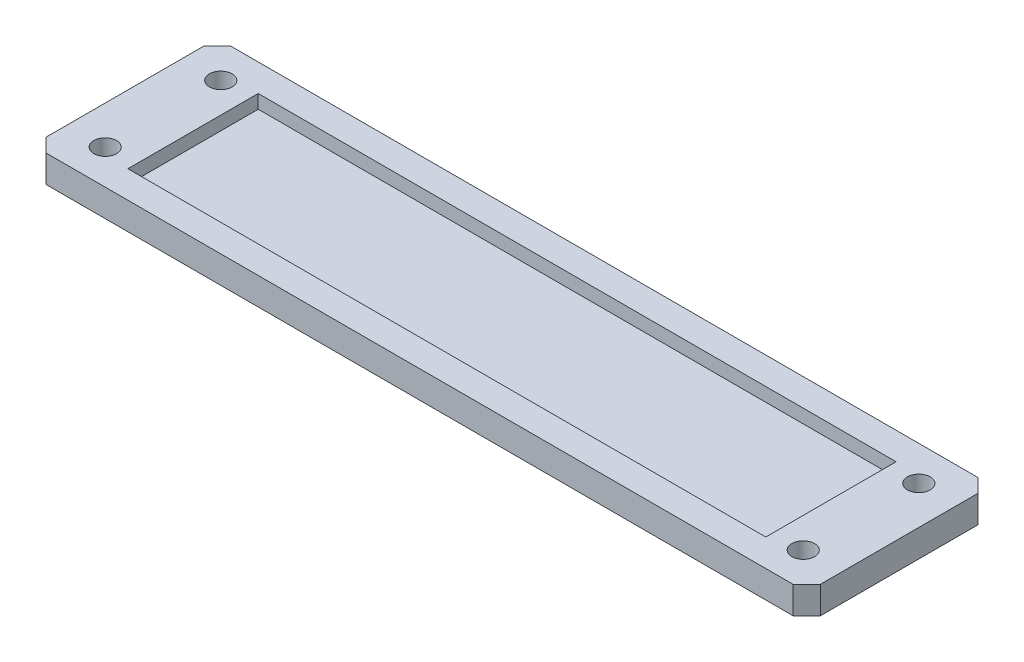
from build123d import *

# Parameters (mm, degrees)
SKETCH1_R           = 2.5
BOSS_EXTRUDE2_DEPTH = 6
SKETCH2_W           = 140.18
SKETCH2_H           = 28.64
CUT_EXTRUDE1_DEPTH  = 3


with BuildPart() as part:
    # Sketch1 → Boss-Extrude2 (new body)
    with BuildSketch(Plane(origin=(0, 0, 0), x_dir=(1, 0, 0), z_dir=(0, 1, 0))):
        Polygon((-85.09, 17.32), (-82.09, 20.32), (82.09, 20.32), (85.09, 17.32), (85.09, -17.32), (82.09, -20.32), (-82.09, -20.32), (-85.09, -17.32), align=None)
        with Locations(Location((-76.7, 12.7, 0), (0, 0, 270))):
            Circle(SKETCH1_R, mode=Mode.SUBTRACT)
        with Locations(Location((-76.7, -12.7, 0), (0, 0, 270))):
            Circle(SKETCH1_R, mode=Mode.SUBTRACT)
        with Locations(Location((76.7, 12.7, 0), (0, 0, 270))):
            Circle(SKETCH1_R, mode=Mode.SUBTRACT)
        with Locations(Location((76.7, -12.7, 0), (0, 0, 270))):
            Circle(SKETCH1_R, mode=Mode.SUBTRACT)
    extrude(amount=BOSS_EXTRUDE2_DEPTH)

    # Sketch2 → Cut-Extrude1 (cut)
    with BuildSketch(Plane(origin=(0, 6, 0), x_dir=(1, 0, 0), z_dir=(0, 1, 0))):
        Rectangle(SKETCH2_W, SKETCH2_H)
    extrude(amount=-CUT_EXTRUDE1_DEPTH, mode=Mode.SUBTRACT)


solid = part.part
